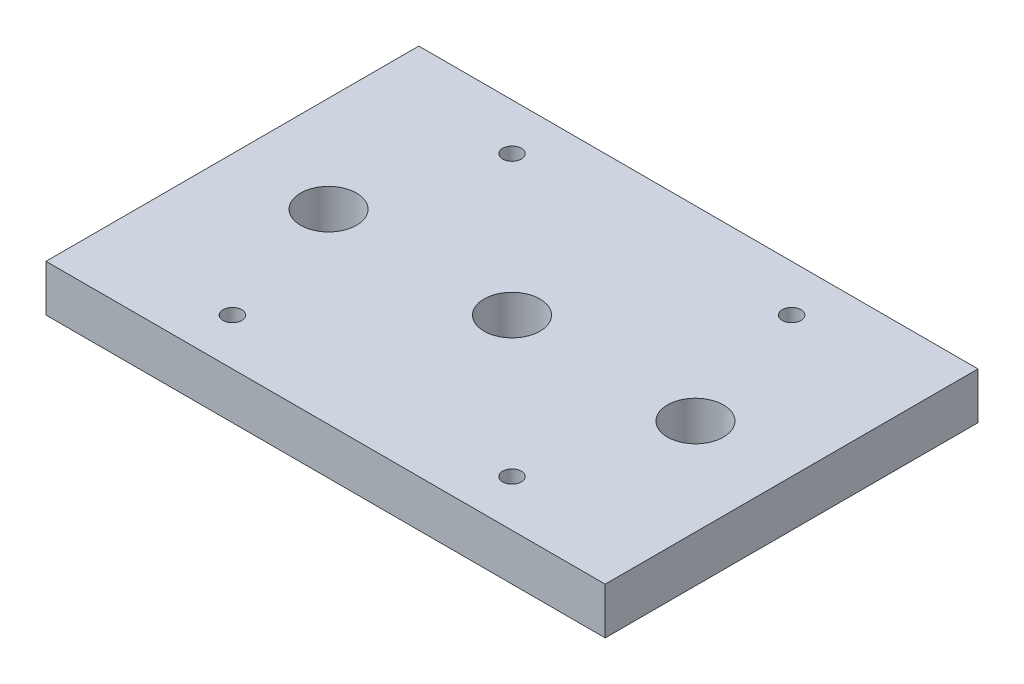
from build123d import *

# Parameters (mm, degrees)
SKETCH1_W                                = 152.4
SKETCH1_H                                = 101.6
BOSS_EXTRUDE1_DEPTH                      = 12.7
CBORE_FOR_3_8_HEX_HEAD_BOLT1_D           = 10.0838
CBORE_FOR_3_8_HEX_HEAD_BOLT1_CBORE_D     = 15.24
CBORE_FOR_3_8_HEX_HEAD_BOLT1_CBORE_DEPTH = 11.176
TAP_DRILL_FOR_1_4_20_TAP1_D              = 5.1054


with BuildPart() as part:
    # Sketch1 → Boss-Extrude1 (new body)
    with BuildSketch(Plane(origin=(0, 0, 0), x_dir=(1, 0, 0), z_dir=(0, 1, 0))):
        Rectangle(SKETCH1_W, SKETCH1_H)
    extrude(amount=BOSS_EXTRUDE1_DEPTH)

    # CBORE for 3/8 Hex Head Bolt1 (through all)
    with Locations(Plane(origin=(0, 12.7, 0), x_dir=(1, 0, 0), z_dir=(0, 1, 0))):
        with Locations((-50.000000076, 0), (50.000000076, 0), (0, 0)):
            CounterBoreHole(CBORE_FOR_3_8_HEX_HEAD_BOLT1_D / 2, CBORE_FOR_3_8_HEX_HEAD_BOLT1_CBORE_D / 2, CBORE_FOR_3_8_HEX_HEAD_BOLT1_CBORE_DEPTH)

    # Tap Drill for 1/4-20 Tap1 (through all)
    with Locations(Plane.XZ):
        with Locations((-38.1, -38.1), (38.1, -38.1), (38.1, 38.1), (-38.1, 38.1)):
            Hole(TAP_DRILL_FOR_1_4_20_TAP1_D / 2)


solid = part.part
